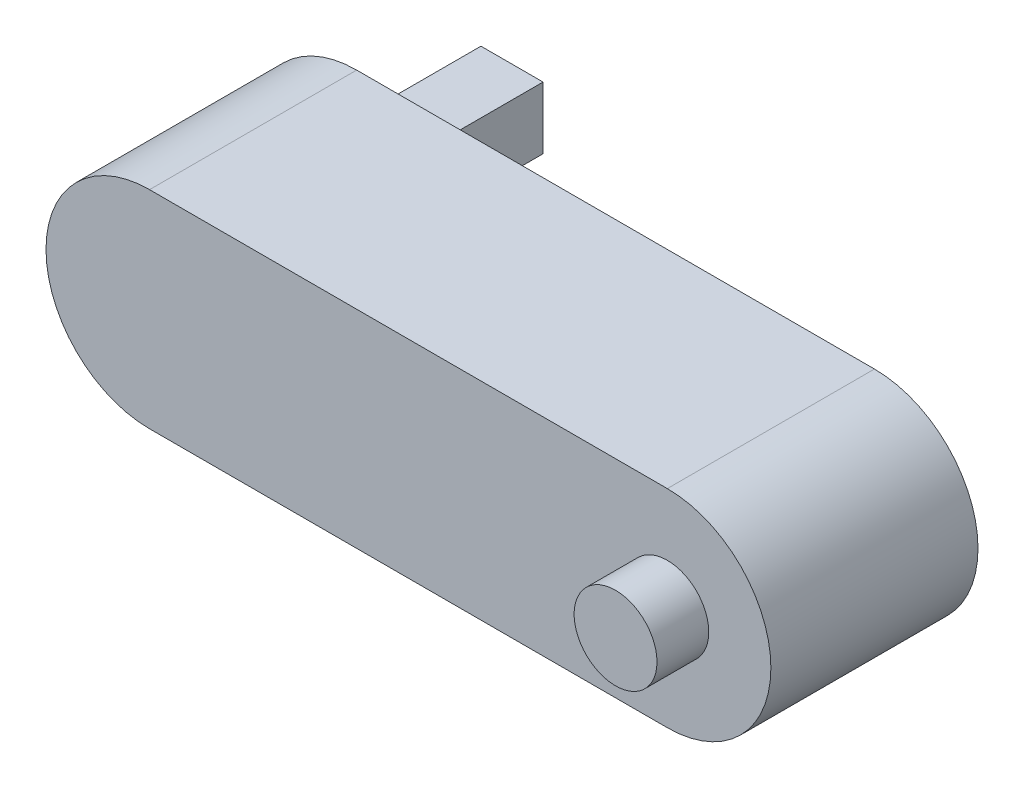
from build123d import *

# Parameters (mm, degrees)
EXTRUDE_1_DEPTH = 20
SKETCH_2_R      = 4
EXTRUDE_2_DEPTH = 5
SKETCH_3_W      = 6
SKETCH_3_H      = 6
EXTRUDE_3_DEPTH = 15


with BuildPart() as part:
    # 草图1 → 凸台-拉伸1 (new body)
    with BuildSketch(Plane.XY):
        with BuildLine():
            Line((0, 10), (50, 10))
            ThreePointArc((50, 10), (60, 0), (50, -10))
            Line((50, -10), (0, -10))
            ThreePointArc((0, -10), (-10, 0), (0, 10))
        make_face()
    extrude(amount=EXTRUDE_1_DEPTH)

    # 草图2 → 凸台-拉伸2 (add)
    with BuildSketch(Plane.XY.offset(20)):
        with Locations((50, 0)):
            Circle(SKETCH_2_R)
    extrude(amount=EXTRUDE_2_DEPTH)

    # 草图3 → 凸台-拉伸3 (add)
    with BuildSketch(Plane(origin=(0, 0, 0), x_dir=(-1, 0, 0), z_dir=(0, 0, -1))):
        Rectangle(SKETCH_3_W, SKETCH_3_H)
    extrude(amount=EXTRUDE_3_DEPTH)


solid = part.part
